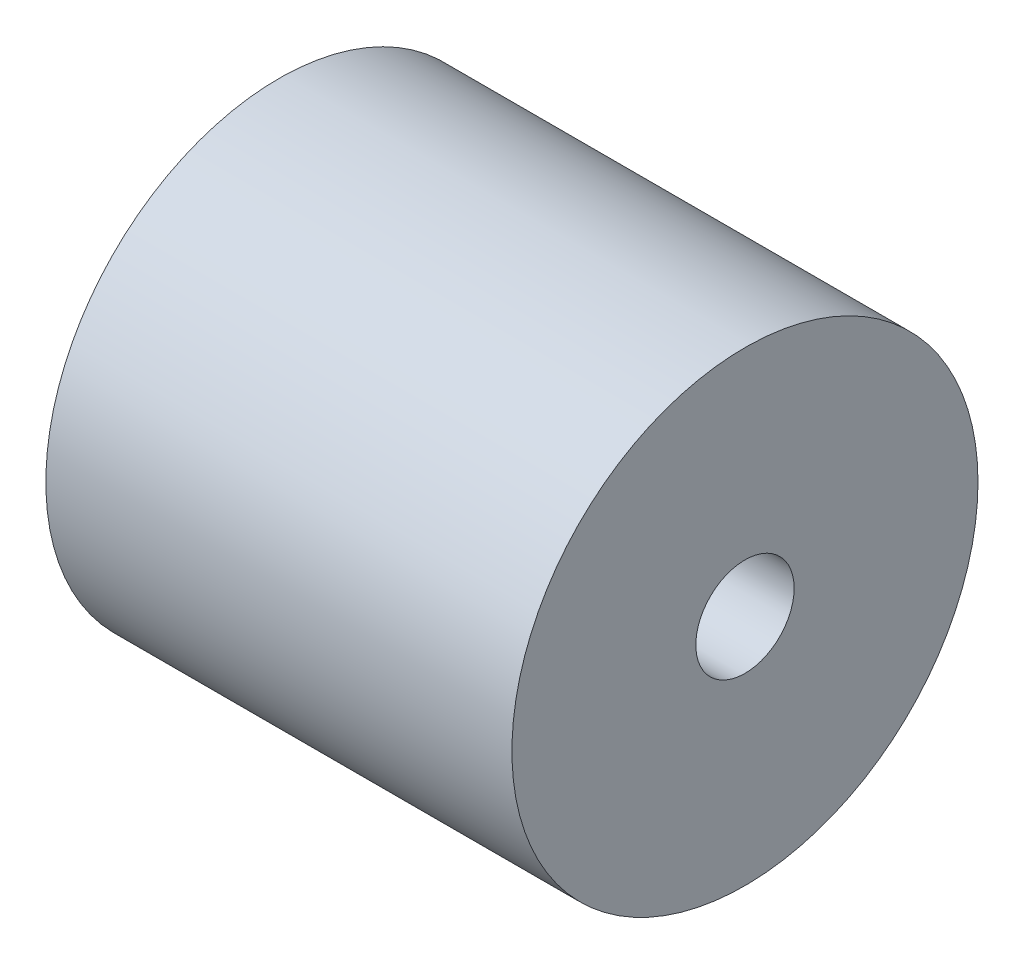
from build123d import *

# Parameters (mm, degrees)
SKETCH1_R           = 25
BOSS_EXTRUDE1_DEPTH = 50
SKETCH2_W           = 2.35
SKETCH2_H           = 3.225


with BuildPart() as part:
    # Sketch1 → Boss-Extrude1 (new body)
    with BuildSketch(Plane(origin=(0, 0, 0), x_dir=(0, 0, -1), z_dir=(1, 0, 0))):
        Circle(SKETCH1_R)
    extrude(amount=BOSS_EXTRUDE1_DEPTH)

    # Sketch2 → Cut-Revolve3 (revolve, cut)
    with BuildSketch(Plane(origin=(0, 0, 0), x_dir=(1, 0, 0), z_dir=(0, 1, 0))):
        Polygon((42, 0), (50, 0), (50, 5.275), (42, 5.275), (42, 4.675), align=None)
        Polygon((39.85, 0), (42, 0), (42, 4.675), (39.85, 4.675), (39.85, 3.225), align=None)
        with Locations((38.675, 1.6125)):
            Rectangle(SKETCH2_W, SKETCH2_H)
    revolve(axis=Axis((50, 0, 0), (-1, 0, 0)), mode=Mode.SUBTRACT)


solid = part.part
